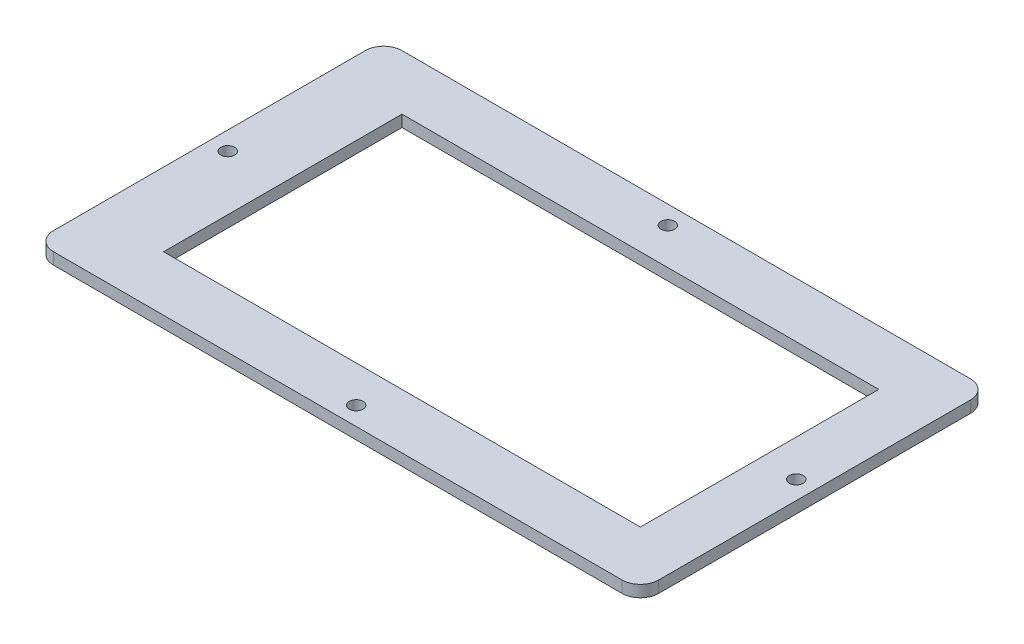
from build123d import *

# Parameters (mm, degrees)
SKETCH1_R           = 1.875
SKETCH1_W           = 130
SKETCH1_H           = 65
BOSS_EXTRUDE1_DEPTH = 3.175


with BuildPart() as part:
    # Sketch1 → Boss-Extrude1 (new body)
    with BuildSketch(Plane(origin=(0, 0, 0), x_dir=(1, 0, 0), z_dir=(0, 1, 0))):
        with BuildLine():
            Line((-5, 0), (-160, 0))
            ThreePointArc((-160, 0), (-163.535533906, 1.464466094), (-165, 5))
            Line((-165, 5), (-165, 90))
            ThreePointArc((-165, 90), (-163.535533906, 93.535533906), (-160, 95))
            Line((-160, 95), (-5, 95))
            ThreePointArc((-5, 95), (-1.464466094, 93.535533906), (0, 90))
            Line((0, 90), (0, 5))
            ThreePointArc((0, 5), (-1.464466094, 1.464466094), (-5, 0))
        make_face()
        with Locations(Location((-160, 47.5, 0), (0, 0, 270))):
            Circle(SKETCH1_R, mode=Mode.SUBTRACT)
        with Locations(Location((-5, 47.5, 0), (0, 0, 270))):
            Circle(SKETCH1_R, mode=Mode.SUBTRACT)
        with Locations(Location((-82.5, 90, 0), (0, 0, 270))):
            Circle(SKETCH1_R, mode=Mode.SUBTRACT)
        with Locations(Location((-82.5, 5, 0), (0, 0, 270))):
            Circle(SKETCH1_R, mode=Mode.SUBTRACT)
        with Locations((-80, 47.5)):
            Rectangle(SKETCH1_W, SKETCH1_H, mode=Mode.SUBTRACT)
    extrude(amount=BOSS_EXTRUDE1_DEPTH)


solid = part.part
